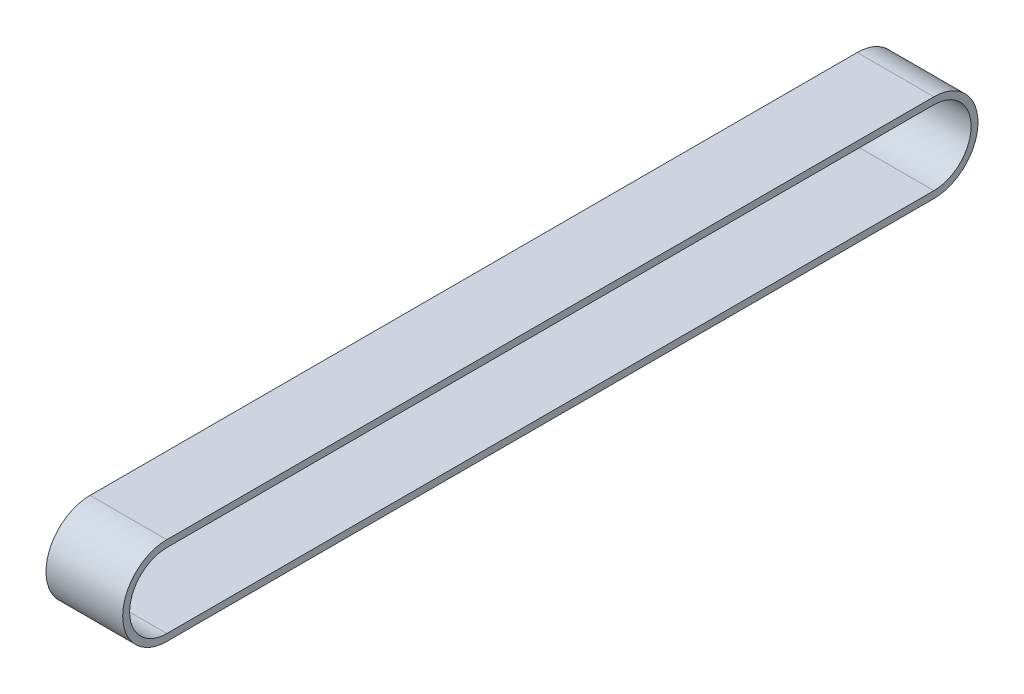
from build123d import *

# Parameters (mm, degrees)
BOSS_EXTRUDE1_DEPTH = 12.7


with BuildPart() as part:
    # Sketch1 → Boss-Extrude1 (new, symmetric)
    with BuildSketch(Plane(origin=(0, 0, 0), x_dir=(0, 0, -1), z_dir=(1, 0, 0))):
        with BuildLine():
            Line((-127, 14.605), (127, 14.605))
            ThreePointArc((127, 14.605), (141.605, 0), (127, -14.605))
            Line((127, -14.605), (-127, -14.605))
            ThreePointArc((-127, -14.605), (-141.605, 0), (-127, 14.605))
        make_face()
        with BuildLine():
            Line((-127, 12.319), (127, 12.319))
            ThreePointArc((127, 12.319), (139.319, 0), (127, -12.319))
            Line((127, -12.319), (-127, -12.319))
            ThreePointArc((-127, -12.319), (-139.319, 0), (-127, 12.319))
        make_face(mode=Mode.SUBTRACT)
    extrude(amount=BOSS_EXTRUDE1_DEPTH, both=True)


solid = part.part
